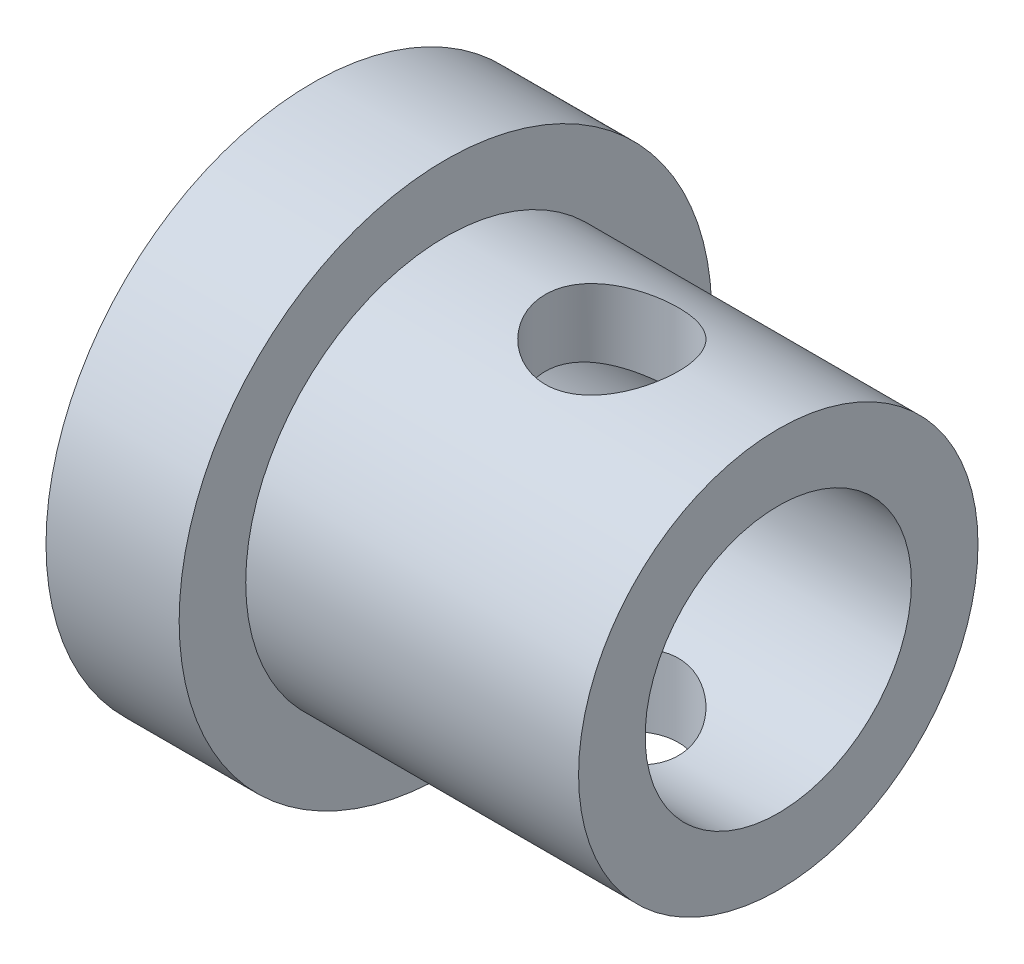
from build123d import *

# Parameters (mm, degrees)
SKETCH1_R               = 3
BOSS_EXTRUDE1_DEPTH     = 3.5
SKETCH2_R               = 4
BOSS_EXTRUDE2_DEPTH     = 2
SKETCH3_R               = 2
CUT_EXTRUDE1_DEPTH      = 10
CUT_EXTRUDE2_DEPTH      = 7.652067348
CUT_EXTRUDE2_DEPTH_BACK = 7.652067348
SKETCH4_R               = 1


with BuildPart() as part:
    # Sketch1 → Boss-Extrude1 (new, symmetric)
    with BuildSketch(Plane(origin=(0, 0, 0), x_dir=(0, 0, -1), z_dir=(1, 0, 0))):
        Circle(SKETCH1_R)
    extrude(amount=BOSS_EXTRUDE1_DEPTH, both=True)

    # Sketch2 → Boss-Extrude2 (add)
    with BuildSketch(Plane.ZY.offset(3.5)):
        Circle(SKETCH2_R)
    extrude(amount=-BOSS_EXTRUDE2_DEPTH)

    # Sketch3 → Cut-Extrude1 (cut, through all)
    with BuildSketch(Plane(origin=(3.5, 0, 0), x_dir=(0, 0, -1), z_dir=(1, 0, 0))):
        Circle(SKETCH3_R)
    extrude(amount=-CUT_EXTRUDE1_DEPTH, mode=Mode.SUBTRACT)

    # Sketch4 → Cut-Extrude2 (cut, two sides: drawn at the far end of the back side and taken through both)
    with BuildSketch(Plane(origin=(0, 0, 0), x_dir=(1, 0, 0), z_dir=(0, 1, 0)).offset(-CUT_EXTRUDE2_DEPTH_BACK)):
        with Locations(Location((1, 0, 0), (0, 0, 270))):
            Circle(SKETCH4_R)
    extrude(amount=CUT_EXTRUDE2_DEPTH + CUT_EXTRUDE2_DEPTH_BACK, mode=Mode.SUBTRACT)


solid = part.part
